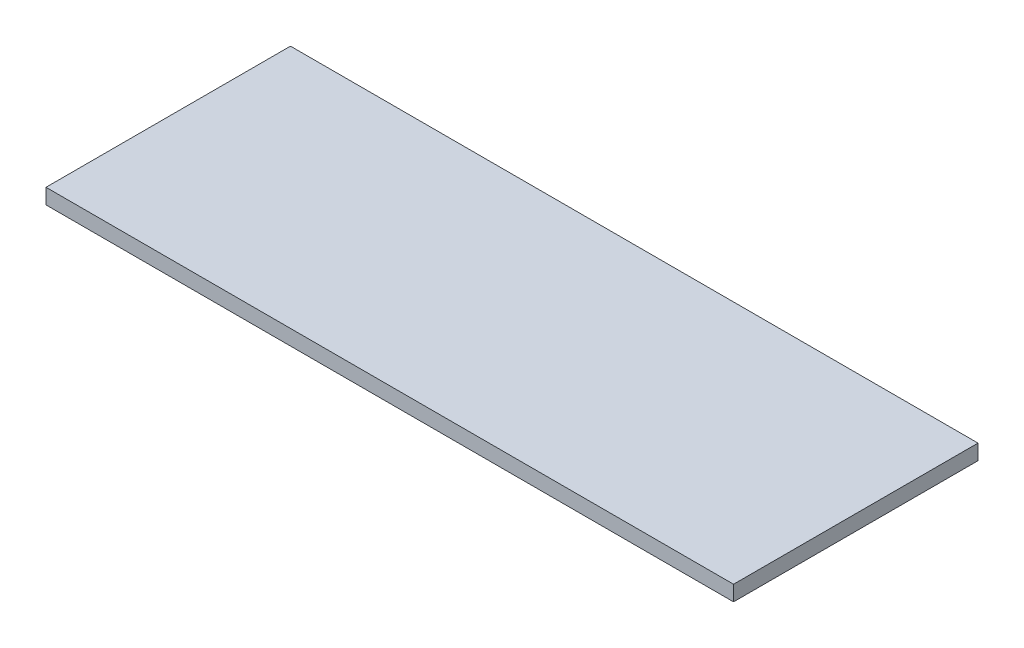
from build123d import *

# Parameters (mm, degrees)
SKETCH1_W           = 90
SKETCH1_H           = 32
BOSS_EXTRUDE1_DEPTH = 2


with BuildPart() as part:
    # Sketch1 → Boss-Extrude1 (new body)
    with BuildSketch(Plane(origin=(0, 0, 0), x_dir=(1, 0, 0), z_dir=(0, 1, 0))):
        Rectangle(SKETCH1_W, SKETCH1_H)
    extrude(amount=BOSS_EXTRUDE1_DEPTH)


solid = part.part
